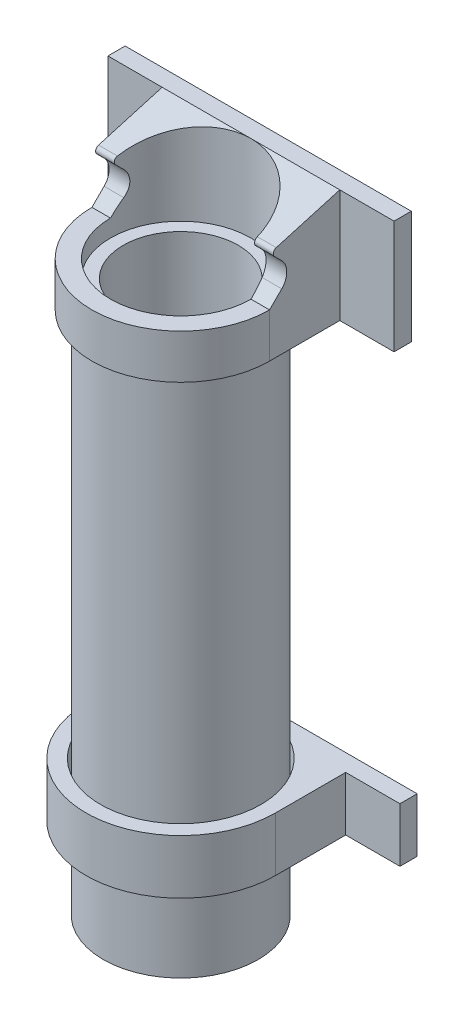
from build123d import *

# Parameters (mm, degrees)
BOSS_EXTRUDE1_DEPTH     = 10
SKETCH16_R              = 29.575
SKETCH16_R_2            = 25.9
BOSS_EXTRUDE2_DEPTH     = 6.35
BOSS_EXTRUDE3_DEPTH     = 25.4
CUT_EXTRUDE1_DEPTH      = 247.098181627
CUT_EXTRUDE1_DEPTH_BACK = 247.098181627
SKETCH19_W              = 6.35
SKETCH19_H              = 41.75
BOSS_EXTRUDE5_DEPTH     = 20
SKETCH20_R              = 29.575
BOSS_EXTRUDE6_DEPTH     = 20


with BuildPart() as part:
    # Sketch12 → Revolve1 (revolve)
    with BuildSketch(Plane.XY, mode=Mode.PRIVATE) as revolve1_sk:
        Polygon((-28.575, 0), (-28.575, 203.2), (-21.22866, 203.2), (-21.22866, 164.7), (-19.177, 164.7), (-19.177, 38.5), (-21.22866, 38.5), (-21.22866, 0), align=None)
    revolve(revolve1_sk.sketch.rotate(Axis((0, 0, 0), (0, 1, 0)), 270), axis=Axis((0, 0, 0), (0, 1, 0)))


with BuildPart() as body_2:
    # Sketch15 → Boss-Extrude1 (new body)
    with BuildSketch(Plane(origin=(0, 193.2, 0), x_dir=(1, 0, 0), z_dir=(0, 1, 0))):
        with BuildLine():
            Line((-32.75, 32.25), (-32.75, 25.9))
            Line((-32.75, 25.9), (-20.043764616, 25.9))
            ThreePointArc((-20.043764616, 25.9), (-13.258102036, 29.946372575), (-5.700877125, 32.25))
            Line((-5.700877125, 32.25), (-32.75, 32.25))
        make_face()
        with BuildLine():
            Line((-32.75, 25.9), (-32.75, 0))
            ThreePointArc((-32.75, 0), (-29.40234507, 14.424444683), (-20.043764616, 25.9))
            Line((-20.043764616, 25.9), (-32.75, 25.9))
        make_face()
        with BuildLine():
            Line((20.043764616, 25.9), (32.75, 25.9))
            Line((32.75, 25.9), (32.75, 32.25))
            Line((32.75, 32.25), (5.700877125, 32.25))
            ThreePointArc((5.700877125, 32.25), (13.258102036, 29.946372575), (20.043764616, 25.9))
        make_face()
        with BuildLine():
            ThreePointArc((20.043764616, 25.9), (29.40234507, 14.424444683), (32.75, 0))
            Line((32.75, 0), (32.75, 25.9))
            Line((32.75, 25.9), (20.043764616, 25.9))
        make_face()
        with BuildLine():
            ThreePointArc((-32.75, 0), (0, -32.75), (32.75, 0))
            ThreePointArc((32.75, 0), (29.40234507, 14.424444683), (20.043764616, 25.9))
            Line((20.043764616, 25.9), (14.278327108, 25.9))
            ThreePointArc((14.278327108, 25.9), (25.465291567, 15.039931861), (29.575, 0))
            ThreePointArc((29.575, 0), (-15.039931861, -25.465291567), (-14.278327108, 25.9))
            Line((-14.278327108, 25.9), (-20.043764616, 25.9))
            ThreePointArc((-20.043764616, 25.9), (-29.40234507, 14.424444683), (-32.75, 0))
        make_face()
        with BuildLine():
            Line((14.278327108, 25.9), (20.043764616, 25.9))
            ThreePointArc((20.043764616, 25.9), (13.258102036, 29.946372575), (5.700877125, 32.25))
            Line((5.700877125, 32.25), (-5.700877125, 32.25))
            ThreePointArc((-5.700877125, 32.25), (-13.258102036, 29.946372575), (-20.043764616, 25.9))
            Line((-20.043764616, 25.9), (-14.278327108, 25.9))
            ThreePointArc((-14.278327108, 25.9), (0, 29.575), (14.278327108, 25.9))
        make_face()
    extrude(amount=BOSS_EXTRUDE1_DEPTH)

    # Sketch16 → Boss-Extrude2 (add)
    # profile 1 of 4: a face of its own
    with BuildSketch(Plane(origin=(0, 203.2, 0), x_dir=(1, 0, 0), z_dir=(0, 1, 0))):
        with BuildLine():
            ThreePointArc((5.700877125, 32.25), (25.092491166, 21.045887652), (32.75, 0))
            Line((32.75, 0), (32.75, 32.25))
            Line((32.75, 32.25), (5.700877125, 32.25))
        make_face()
    # profile 2 of 4: a face of its own
    with BuildSketch(Plane(origin=(0, 203.2, 0), x_dir=(1, 0, 0), z_dir=(0, 1, 0))):
        with BuildLine():
            Line((-32.75, 32.25), (-32.75, 0))
            ThreePointArc((-32.75, 0), (-25.092491166, 21.045887652), (-5.700877125, 32.25))
            Line((-5.700877125, 32.25), (-32.75, 32.25))
        make_face()
    # profile 3 of 4: a face of its own
    with BuildSketch(Plane(origin=(0, 203.2, 0), x_dir=(1, 0, 0), z_dir=(0, 1, 0))):
        with BuildLine():
            ThreePointArc((-32.75, 0), (0, -32.75), (32.75, 0))
            ThreePointArc((32.75, 0), (25.092491166, 21.045887652), (5.700877125, 32.25))
            Line((5.700877125, 32.25), (-5.700877125, 32.25))
            ThreePointArc((-5.700877125, 32.25), (-25.092491166, 21.045887652), (-32.75, 0))
        make_face()
        with Locations(Location((0, 0, 0), (0, 0, 90))):
            Circle(SKETCH16_R, mode=Mode.SUBTRACT)
    # profile 4 of 4: a face of its own
    with BuildSketch(Plane(origin=(0, 203.2, 0), x_dir=(1, 0, 0), z_dir=(0, 1, 0))):
        with Locations(Location((0, 0, 0), (0, 0, 90))):
            Circle(SKETCH16_R)
        with Locations(Location((0, 0, 0), (0, 0, 270))):
            Circle(SKETCH16_R_2, mode=Mode.SUBTRACT)
    extrude(amount=BOSS_EXTRUDE2_DEPTH)

    # Sketch17 → Boss-Extrude3 (add)
    with BuildSketch(Plane(origin=(0, 209.55, 0), x_dir=(1, 0, 0), z_dir=(0, 1, 0))):
        Polygon((0, 25.9), (32.75, 25.9), (32.75, 32.25), (-32.75, 32.25), (-32.75, 25.9), align=None)
        with BuildLine():
            Line((32.75, 0), (32.75, 25.9))
            Line((32.75, 25.9), (0, 25.9))
            ThreePointArc((0, 25.9), (18.314065633, 18.314065633), (25.9, 0))
            Line((25.9, 0), (32.75, 0))
        make_face()
        with BuildLine():
            ThreePointArc((-25.9, 0), (-18.314065633, 18.314065633), (0, 25.9))
            Line((0, 25.9), (-32.75, 25.9))
            Line((-32.75, 25.9), (-32.75, 0))
            Line((-32.75, 0), (-25.9, 0))
        make_face()
    extrude(amount=BOSS_EXTRUDE3_DEPTH)

    # Sketch18 → Cut-Extrude1 (cut, two sides: drawn at the far end of the back side and taken through both)
    with BuildSketch(Plane.ZY.offset(32.75).offset(-CUT_EXTRUDE1_DEPTH_BACK)):
        with BuildLine():
            Line((0, 224.880256121), (0, 227.510512242))
            Line((0, 227.510512242), (-1.799705242, 225.710807))
            Line((-1.799705242, 225.710807), (-4.490128061, 223.020384182))
            ThreePointArc((-4.490128061, 223.020384182), (-2.430039796, 224.396891152), (0, 224.880256121))
        make_face()
        with BuildLine():
            Line((0, 227.510512242), (-2.446251923, 228.213170977))
            ThreePointArc((-2.446251923, 228.213170977), (-1.662206389, 227.673916492), (-1.360365456, 226.77146713))
            ThreePointArc((-1.360365456, 226.77146713), (-1.474546145, 226.197442009), (-1.799705242, 225.710807))
            Line((-1.799705242, 225.710807), (0, 227.510512242))
        make_face()
        with BuildLine():
            ThreePointArc((6.35, 218.530256121), (4.490128061, 223.020384182), (0, 224.880256121))
            Line((0, 224.880256121), (0, 212.180256121))
            ThreePointArc((0, 212.180256121), (4.490128061, 214.04012806), (6.35, 218.530256121))
        make_face()
        with BuildLine():
            Line((0, 212.180256121), (0, 224.880256121))
            ThreePointArc((0, 224.880256121), (-2.430039796, 224.396891152), (-4.490128061, 223.020384182))
            ThreePointArc((-4.490128061, 223.020384182), (-6.35, 218.530256121), (-4.490128061, 214.04012806))
            ThreePointArc((-4.490128061, 214.04012806), (-2.430039796, 212.66362109), (0, 212.180256121))
        make_face()
        with BuildLine():
            Line((0, 209.55), (0, 212.180256121))
            ThreePointArc((0, 212.180256121), (-2.430039796, 212.66362109), (-4.490128061, 214.04012806))
            Line((-4.490128061, 214.04012806), (0, 209.55))
        make_face()
        Polygon((0, 234.95), (-25.9, 234.95), (-2.446251923, 228.213170977), (0, 227.510512242), align=None)
    extrude(amount=CUT_EXTRUDE1_DEPTH + CUT_EXTRUDE1_DEPTH_BACK, mode=Mode.SUBTRACT)

    # Sketch19 → Boss-Extrude5 (add)
    with BuildSketch(Plane(origin=(32.75, 0, 0), x_dir=(0, 0, -1), z_dir=(1, 0, 0))):
        with Locations((29.075, 214.075)):
            Rectangle(SKETCH19_W, SKETCH19_H)
    boss_extrude5 = extrude(amount=BOSS_EXTRUDE5_DEPTH)

    # Mirror1: Boss-Extrude5 across plane
    add(boss_extrude5.mirror(Plane(origin=(0, 0, 0), x_dir=(0, 0, 1), z_dir=(1, 0, 0))))


with BuildPart() as body_3:
    # Sketch20 → Boss-Extrude6 (new body)
    with BuildSketch(Plane(origin=(0, 30, 0), x_dir=(-1, 0, 0), z_dir=(0, -1, 0))):
        with BuildLine():
            ThreePointArc((-34.925, 0), (0, -34.925), (34.925, 0))
            Line((34.925, 0), (34.925, 25.9))
            Line((34.925, 25.9), (54.925, 25.9))
            Line((54.925, 25.9), (54.925, 32.25))
            Line((54.925, 32.25), (-54.925, 32.25))
            Line((-54.925, 32.25), (-54.925, 25.9))
            Line((-54.925, 25.9), (-34.925, 25.9))
            Line((-34.925, 25.9), (-34.925, 0))
        make_face()
        with Locations(Location((0, 0, 0), (0, 0, 90))):
            Circle(SKETCH20_R, mode=Mode.SUBTRACT)
    extrude(amount=-BOSS_EXTRUDE6_DEPTH)


solid = Compound([part.part, body_2.part, body_3.part])
